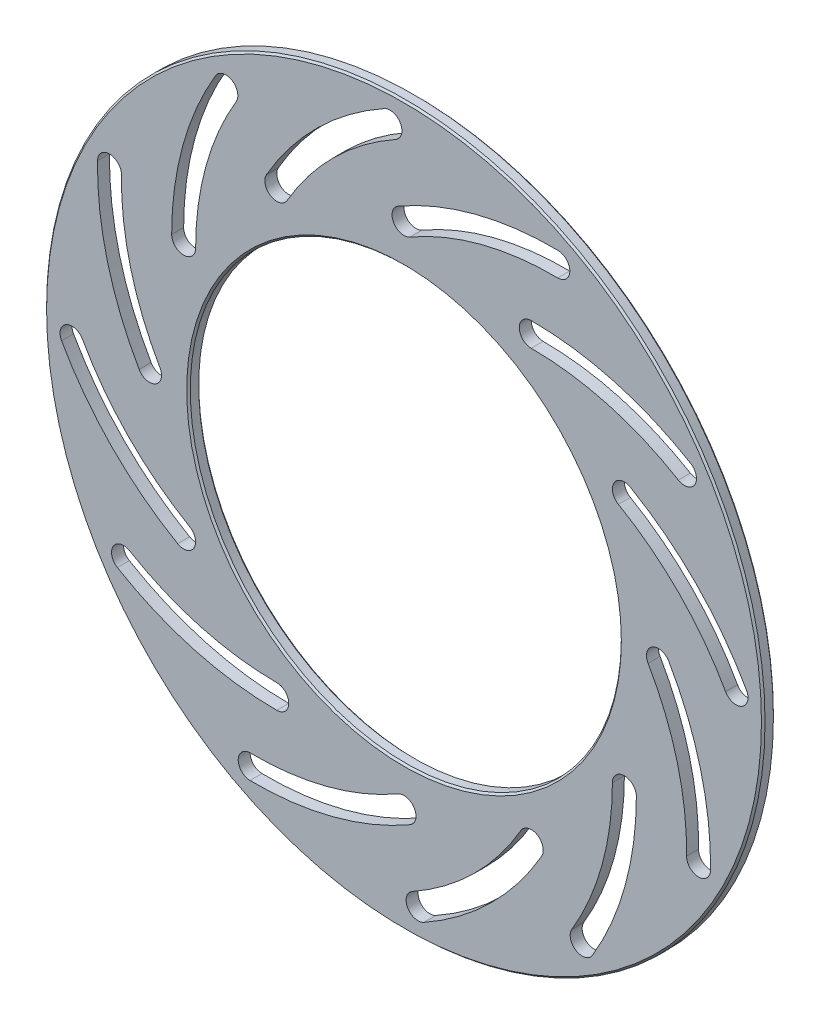
from build123d import *

# Parameters (mm, degrees)
SKETCH1_R           = 60
SKETCH1_R_2         = 36
BOSS_EXTRUDE1_DEPTH = 2
CUT_EXTRUDE1_DEPTH  = 85.876380696
CIRPATTERN1_COUNT   = 12
CHAMFER1_SIZE       = 0.3


with BuildPart() as part:
    # Sketch1 → Boss-Extrude1 (new body)
    with BuildSketch(Plane.XY):
        Circle(SKETCH1_R)
        Circle(SKETCH1_R_2, mode=Mode.SUBTRACT)
    extrude(amount=BOSS_EXTRUDE1_DEPTH)

    # Sketch2 → Cut-Extrude1 (cut, through all)
    with BuildSketch(Plane.XY.offset(2)):
        with BuildLine():
            ThreePointArc((25.722326885, 51.193712683), (11.890599802, 49.519139452), (-1, 44.232050808))
            ThreePointArc((-1, 44.232050808), (-1.732050808, 41.5), (1, 40.767949192))
            ThreePointArc((1, 40.767949192), (12.899015202, 45.64833871), (25.666763279, 47.194098616))
            ThreePointArc((25.666763279, 47.194098616), (27.694352115, 49.166123846), (25.722326885, 51.193712683))
        make_face()
    cut_extrude1 = extrude(amount=-CUT_EXTRUDE1_DEPTH, mode=Mode.SUBTRACT)

    # CirPattern1: Cut-Extrude1 ×12 about axis
    cirpattern1_axis = Axis((0, 0, 0), (0, 0, 1))
    for i in range(1, CIRPATTERN1_COUNT):
        add(cut_extrude1.rotate(cirpattern1_axis, i * 360 / CIRPATTERN1_COUNT), mode=Mode.SUBTRACT)

    # Chamfer1
    chamfer1_edges = [part.edges().sort_by_distance(p)[0] for p in [
        (-60, 0, 0),
        (-60, 0, 2),
        (-36, 0, 0),
        (-36, 0, 2),
    ]]
    chamfer(chamfer1_edges, length=CHAMFER1_SIZE)


solid = part.part
